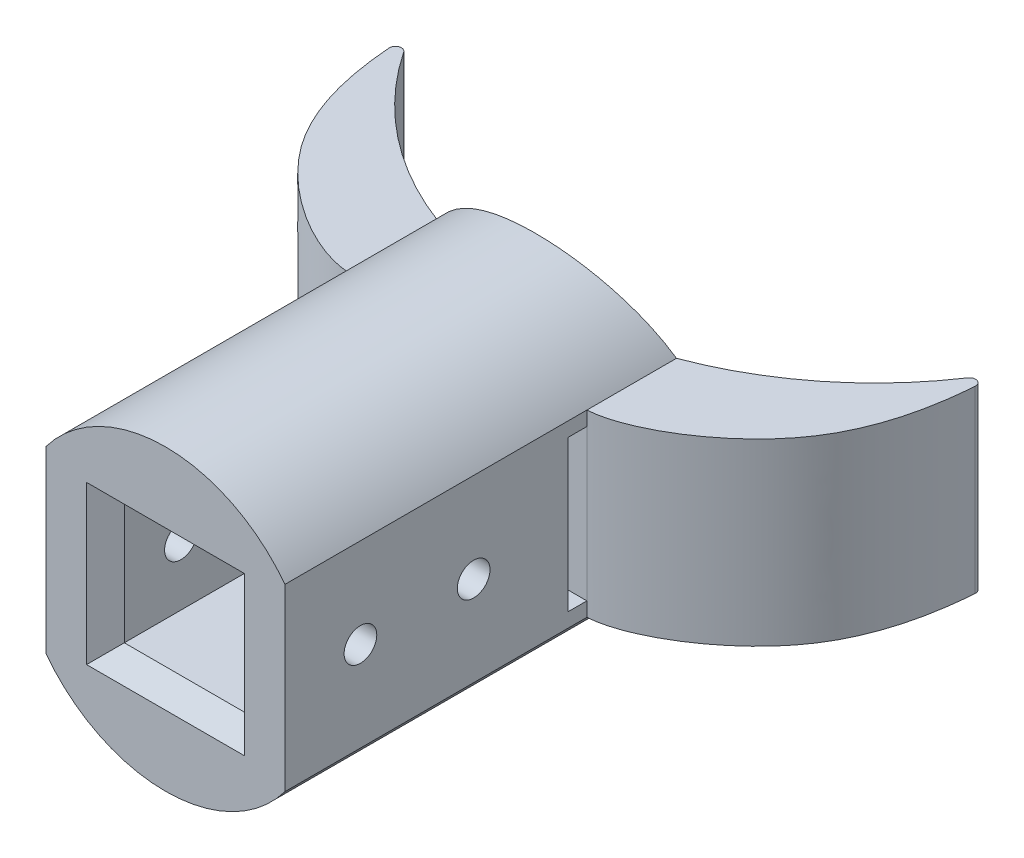
from build123d import *

# Parameters (mm, degrees)
SKETCH_1_W           = 40.2
SKETCH_1_H           = 30.2
SKETCH_1_W_2         = 20.2
SKETCH_1_H_2         = 20.2
EXTRUDE_1_DEPTH      = 50.8
EXTRUDE_2_DEPTH      = 10
EXTRUDE_2_DEPTH_BACK = 40.2
SKETCH_4_W           = 3.2
SKETCH_4_H           = 25.4
CUT_EXTRUDE_2_DEPTH  = 93.927513655
CHAMFER_1_SIZE       = 3.175
HOLE_WIZARD_M5_1_D   = 5.5
EXTRUDE_3_DEPTH      = 50.8
CUT_EXTRUDE_3_DEPTH  = 112.847190984


with BuildPart() as part:
    # 草图1 → 凸台-拉伸1 (new body)
    with BuildSketch(Plane.XY):
        with Locations((10.1, 10.1)):
            Rectangle(SKETCH_1_W, SKETCH_1_H)
        with Locations((10.1, 10.1)):
            Rectangle(SKETCH_1_W_2, SKETCH_1_H_2, mode=Mode.SUBTRACT)
    extrude(amount=EXTRUDE_1_DEPTH)

    # 草图3 → 凸台-拉伸2 (add, two sides: drawn at the far end of the back side and taken through both)
    with BuildSketch(Plane(origin=(0, 25.2, 0), x_dir=(1, 0, 0), z_dir=(0, 1, 0)).offset(-EXTRUDE_2_DEPTH_BACK)):
        with BuildLine():
            Line((-10, 0), (30.2, 0))
            add(Edge.make_bspline(
                [(30.2, 0), (36.683134474, 0.377878079), (55.880340128, 11.98777216), (58.933962636, 29.945985381), (59.393514037, 36.119152658)],
                knots=[0, 0, 0, 0, 0.46638288, 0.846265587, 0.846265587, 0.846265587, 0.846265587], degree=3))
            ThreePointArc((59.393514037, 36.119152658), (58.722687502, 37.138617507), (57.565727076, 36.75034004))
            ThreePointArc((57.565727076, 36.75034004), (10.1, 11.43), (-37.365727076, 36.75034004))
            ThreePointArc((-37.365727076, 36.75034004), (-38.522687502, 37.138617507), (-39.193514037, 36.119152658))
            add(Edge.make_bspline(
                [(-10, 0), (-16.483134474, 0.377878079), (-35.680340128, 11.98777216), (-38.733962636, 29.945985381), (-39.193514037, 36.119152658)],
                knots=[0, 0, 0, 0, 0.46638288, 0.846265587, 0.846265587, 0.846265587, 0.846265587], degree=3))
        make_face()
    extrude(amount=EXTRUDE_2_DEPTH + EXTRUDE_2_DEPTH_BACK)

    # 草图4 → 切除-拉伸2 (cut, through all)
    with BuildSketch(Plane.ZY.offset(10)):
        with Locations((1.6, 10.1)):
            Rectangle(SKETCH_4_W, SKETCH_4_H)
    extrude(amount=-CUT_EXTRUDE_2_DEPTH, mode=Mode.SUBTRACT)

    # 倒角1
    chamfer_1_edges = [part.edges().sort_by_distance(p)[0] for p in [
        (20.2, 10.1, 50.8),
        (10.1, 0, 50.8),
        (0, 10.1, 50.8),
        (10.1, 20.2, 50.8),
    ]]
    chamfer(chamfer_1_edges, length=CHAMFER_1_SIZE)

    # M5 间隙孔1 (through all)
    with Locations(Plane(origin=(30.2, 10.1, 38.1), x_dir=(0, 0, 1), z_dir=(1, 0, 0))):
        with Locations((0, 0), (-19.05, 0)):
            Hole(HOLE_WIZARD_M5_1_D / 2)

    # 草图12 → 凸台-拉伸3 (add)
    with BuildSketch(Plane.XY.offset(50.8)):
        with BuildLine():
            Line((-10, 25.2), (30.2, 25.2))
            ThreePointArc((30.2, 25.2), (10.1, 35.2), (-10, 25.2))
        make_face()
        with BuildLine():
            Line((-10, -5), (30.2, -5))
            ThreePointArc((30.2, -5), (10.1, -15), (-10, -5))
        make_face()
    extrude(amount=-EXTRUDE_3_DEPTH)

    # 草图14 → 切除-拉伸3 (cut, through all)
    with BuildSketch(Plane.XY.offset(50.8)):
        with BuildLine():
            Line((-53.451610889, 25.2), (-10, 25.2))
            ThreePointArc((-10, 25.2), (-1.125083519, 32.561917872), (10.1, 35.2))
            Line((10.1, 35.2), (-53.451610889, 35.2))
            Line((-53.451610889, 35.2), (-53.451610889, 25.2))
        make_face()
        with BuildLine():
            Line((73.651610889, 35.2), (10.1, 35.2))
            ThreePointArc((10.1, 35.2), (21.325083519, 32.561917872), (30.2, 25.2))
            Line((30.2, 25.2), (73.651610889, 25.2))
            Line((73.651610889, 25.2), (73.651610889, 35.2))
        make_face()
        with BuildLine():
            ThreePointArc((10.1, -15), (-1.125083519, -12.361917872), (-10, -5))
            Line((-10, -5), (-53.451610889, -5))
            Line((-53.451610889, -5), (-53.451610889, -15))
            Line((-53.451610889, -15), (10.1, -15))
        make_face()
        with BuildLine():
            ThreePointArc((30.2, -5), (21.325083519, -12.361917872), (10.1, -15))
            Line((10.1, -15), (73.651610889, -15))
            Line((73.651610889, -15), (73.651610889, -5))
            Line((73.651610889, -5), (30.2, -5))
        make_face()
    extrude(amount=-CUT_EXTRUDE_3_DEPTH, mode=Mode.SUBTRACT)


solid = part.part
